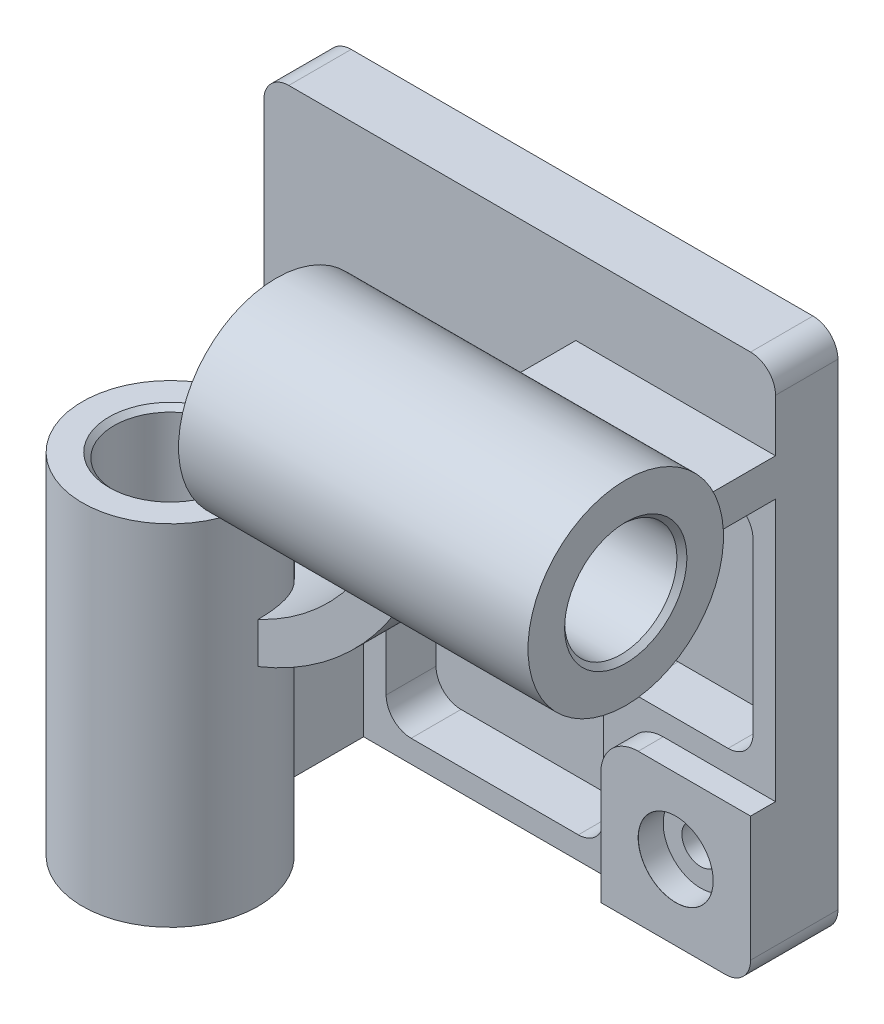
from build123d import *

# Parameters (mm, degrees)
SKETCH1_W               = 205
SKETCH1_H               = 211
BOSS_EXTRUDE1_DEPTH     = 25
BOSS_EXTRUDE2_START     = -25
SKETCH2_W               = 60
SKETCH2_H               = 60
BOSS_EXTRUDE2_DEPTH     = 10
FILLET1_R               = 10
BOSS_EXTRUDE3_DEPTH     = 95
BOSS_EXTRUDE4_START     = 10
SKETCH5_R               = 35.166666667
BOSS_EXTRUDE4_DEPTH     = 140
SKETCH6_R               = 22.5
CUT_EXTRUDE1_DEPTH      = 140
BOSS_EXTRUDE5_START     = 10
SKETCH7_R               = 39.165
BOSS_EXTRUDE5_DEPTH     = 140
SKETCH8_R               = 22.5
CUT_EXTRUDE2_DEPTH      = 319.557726497
CUT_EXTRUDE5_DEPTH      = 35
CUT_EXTRUDE5_DEPTH_BACK = 15
CUT_EXTRUDE5_START      = -5
FILLET2_R               = 15
FILLET3_R               = 10
CHAMFER1_SIZE           = 2
CHAMFER2_SIZE           = 2


with BuildPart() as part:
    # Sketch1 → Boss-Extrude1 (new body)
    with BuildSketch(Plane.XY):
        with Locations((77.5, -74.5)):
            Rectangle(SKETCH1_W, SKETCH1_H)
    extrude(amount=BOSS_EXTRUDE1_DEPTH)

    # Sketch2 → Boss-Extrude2 (add)
    with BuildSketch(Plane(origin=(0, 0, 0), x_dir=(-1, 0, 0), z_dir=(0, 0, -1)).offset(BOSS_EXTRUDE2_START)):
        with Locations((-150, -150)):
            Rectangle(SKETCH2_W, SKETCH2_H)
    extrude(amount=-BOSS_EXTRUDE2_DEPTH)

    # Fillet1
    fillet1_edges = [part.edges().sort_by_distance(p)[0] for p in [
        (-25, 31, 12.5),
        (180, 31, 12.5),
        (180, -180, 17.5),
        (-25, -180, 12.5),
    ]]
    fillet(fillet1_edges, radius=FILLET1_R)

    # Sketch4 → Boss-Extrude3 (add)
    with BuildSketch(Plane.XY):
        with BuildLine():
            Line((0, -180), (0, -100))
            ThreePointArc((0, -100), (70.710678119, -70.710678119), (100, 0))
            Line((100, 0), (180, 0))
            Line((180, 0), (180, -15))
            Line((180, -15), (114.01754251, -15))
            ThreePointArc((114.01754251, -15), (81.317279836, -81.317279836), (15, -114.01754251))
            Line((15, -114.01754251), (15, -180))
            Line((15, -180), (0, -180))
        make_face()
    extrude(amount=BOSS_EXTRUDE3_DEPTH)

    # Sketch5 → Boss-Extrude4 (add)
    with BuildSketch(Plane.XZ.offset(180).offset(BOSS_EXTRUDE4_START)):
        with Locations((7.5, 95)):
            Circle(SKETCH5_R)
    extrude(amount=-BOSS_EXTRUDE4_DEPTH)

    # Sketch6 → Cut-Extrude1 (cut)
    with BuildSketch(Plane.XZ.offset(190)):
        with Locations((7.5, 95)):
            Circle(SKETCH6_R)
    extrude(amount=-CUT_EXTRUDE1_DEPTH, mode=Mode.SUBTRACT)

    # Sketch7 → Boss-Extrude5 (add)
    with BuildSketch(Plane(origin=(180, 0, 0), x_dir=(0, 0, -1), z_dir=(1, 0, 0)).offset(BOSS_EXTRUDE5_START)):
        with Locations(Location((-95, -7.5, 0), (0, 0, 90))):
            Circle(SKETCH7_R)
    extrude(amount=-BOSS_EXTRUDE5_DEPTH)

    # Sketch8 → Cut-Extrude2 (cut, through all)
    with BuildSketch(Plane(origin=(190, 0, 0), x_dir=(0, 0, -1), z_dir=(1, 0, 0))):
        with Locations(Location((-95, -7.5, 0), (0, 0, 90))):
            Circle(SKETCH8_R)
    extrude(amount=-CUT_EXTRUDE2_DEPTH, mode=Mode.SUBTRACT)

    # Sketch10 → Cut-Extrude5 (cut, two sides: drawn at the far end of the back side and taken through both)
    with BuildSketch(Plane.XY.offset(25).offset(CUT_EXTRUDE5_START - CUT_EXTRUDE5_DEPTH_BACK)):
        with BuildLine():
            Line((171, -33.428803755), (171, -101))
            ThreePointArc((171, -101), (168.071067812, -108.071067812), (161, -111))
            Line((161, -111), (121, -111))
            ThreePointArc((121, -111), (113.928932188, -113.928932188), (111, -121))
            Line((111, -121), (111, -161))
            ThreePointArc((111, -161), (108.071067812, -168.071067812), (101, -171))
            Line((101, -171), (34, -171))
            ThreePointArc((34, -171), (26.928932188, -168.071067812), (24, -161))
            Line((24, -161), (24, -136.527840403))
            Line((24, -136.527840403), (24, -121.655250606))
            ThreePointArc((24, -121.655250606), (87.681240867, -87.681240867), (121.655250606, -24))
            Line((121.655250606, -24), (132.503249765, -24))
            Line((132.503249765, -24), (164.331315018, -24))
            ThreePointArc((164.331315018, -24), (169.164347806, -27.654427173), (171, -33.428803755))
        make_face()
    extrude(amount=CUT_EXTRUDE5_DEPTH + CUT_EXTRUDE5_DEPTH_BACK, mode=Mode.SUBTRACT)

    # Sketch15 → CBORE for M8 Hex Head Bolt2 (revolve, cut)
    with BuildSketch(Plane(origin=(150, -150, 35), x_dir=(0, -1, 0), z_dir=(1, 0, 0))):
        Polygon((0, 0), (0, 35), (7.5, 35), (7.5, 10), (15, 10), (15, 0.025), (15.025, 0), align=None)
    revolve(axis=Axis((150, -150, 41.35), (0, 0, -1)), mode=Mode.SUBTRACT)

    # Fillet2
    fillet2_edges = [part.edges().sort_by_distance(p)[0] for p in [
        (120, -120, 30),
    ]]
    fillet(fillet2_edges, radius=FILLET2_R)

    # Fillet3
    fillet3_edges = [part.edges().sort_by_distance(p)[0] for p in [
        (24, -121.655250606, 15),
        (121.655250606, -24, 15),
    ]]
    fillet(fillet3_edges, radius=FILLET3_R)

    # Chamfer1
    chamfer1_edges = [part.edges().sort_by_distance(p)[0] for p in [
        (-15, -50, 95),
        (-15, -190, 95),
    ]]
    chamfer(chamfer1_edges, length=CHAMFER1_SIZE)

    # Chamfer2
    chamfer2_edges = [part.edges().sort_by_distance(p)[0] for p in [
        (50, -30, 95),
        (190, -30, 95),
    ]]
    chamfer(chamfer2_edges, length=CHAMFER2_SIZE)


solid = part.part
